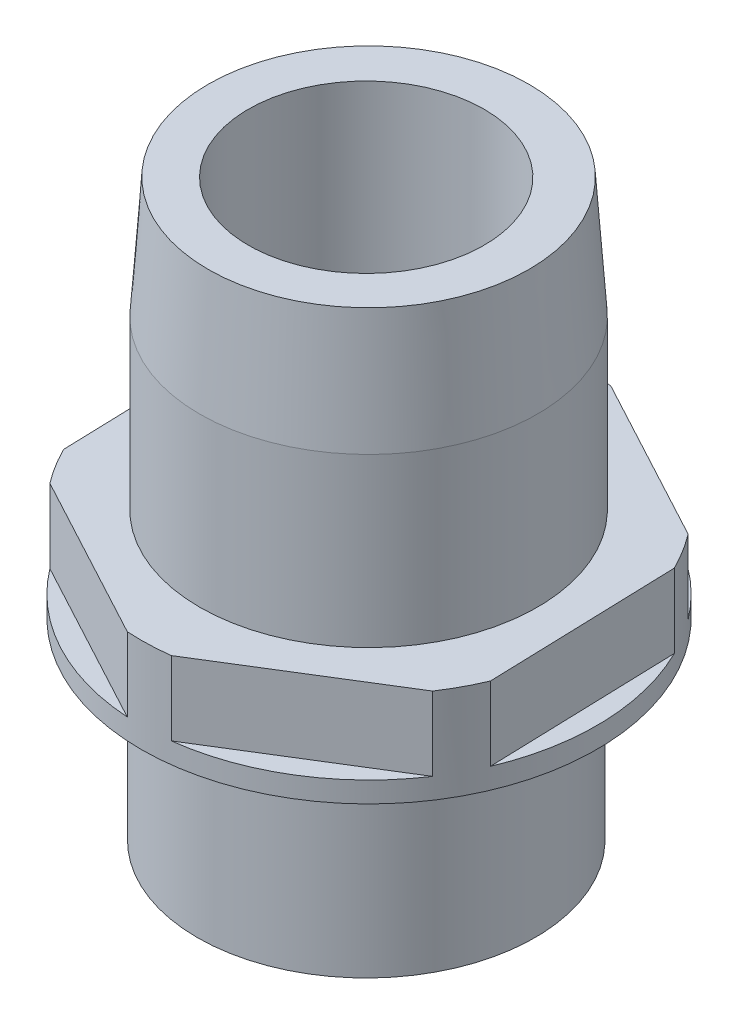
from build123d import *
from build123d.topology import SkipClean

# Parameters (mm, degrees)
SKETCH1_R           = 18.161
BOSS_EXTRUDE1_DEPTH = 1.651
BOSS_EXTRUDE2_DEPTH = 5.8928
CUT_EXTRUDE1_REACH  = 45.689
SKETCH5_R           = 13.462
BOSS_EXTRUDE3_DEPTH = 13.335
SKETCH6_R           = 13.462
BOSS_EXTRUDE4_DEPTH = 9.652
BOSS_EXTRUDE4_TAPER = 4
SKETCH7_R           = 13.462
BOSS_EXTRUDE5_DEPTH = 15.24
SKETCH8_R           = 9.398
CUT_EXTRUDE3_DEPTH  = 63.427016824


with BuildPart() as part:
    # Sketch1 → Boss-Extrude1 (new body)
    with BuildSketch(Plane(origin=(0, 0, 0), x_dir=(1, 0, 0), z_dir=(0, 1, 0))):
        with Locations(Location((-14.328841802, 9.162551515, 0), (0, 0, 90))):
            Circle(SKETCH1_R)
    extrude(amount=BOSS_EXTRUDE1_DEPTH)

    # Sketch2 → Boss-Extrude2 (add)
    with BuildSketch(Plane(origin=(0, 1.651, 0), x_dir=(1, 0, 0), z_dir=(0, 1, 0))):
        Polygon((2.466775283, 0.14327327), (1.879890825, 19.198343461), (-14.91572626, 28.217621706), (-31.124458887, 18.18182976), (-30.537574428, -0.87324043), (-13.741957343, -9.892518675), align=None)
    extrude(amount=BOSS_EXTRUDE2_DEPTH)

    # Sketch3 → Cut-Extrude1 (cut, up to next)
    with BuildSketch(Plane(origin=(0, 7.5438, 0), x_dir=(1, 0, 0), z_dir=(0, 1, 0)), mode=Mode.PRIVATE) as cut_extrude1_sk1:
        with BuildLine():
            Line((-13.183471606, 27.287397669), (-14.91572626, 28.217621706))
            Line((-14.91572626, 28.217621706), (-16.587451234, 27.182557187))
            ThreePointArc((-16.587451234, 27.182557187), (-14.887924337, 27.314943857), (-13.183471606, 27.287397669))
        make_face()
    cut_extrude1_tool1 = extrude(cut_extrude1_sk1.sketch, amount=-CUT_EXTRUDE1_REACH, mode=Mode.PRIVATE) & part.part
    # Sketch3 → Cut-Extrude1 (cut, up to next)
    with BuildSketch(Plane(origin=(0, 7.5438, 0), x_dir=(1, 0, 0), z_dir=(0, 1, 0)), mode=Mode.PRIVATE) as cut_extrude1_sk2:
        with BuildLine():
            Line((1.879890825, 19.198343461), (0.147636171, 20.128567497))
            ThreePointArc((0.147636171, 20.128567497), (1.112049838, 18.722927364), (1.940420505, 17.233054906))
            Line((1.940420505, 17.233054906), (1.879890825, 19.198343461))
        make_face()
    cut_extrude1_tool2 = extrude(cut_extrude1_sk2.sketch, amount=-CUT_EXTRUDE1_REACH, mode=Mode.PRIVATE) & part.part
    # Sketch3 → Cut-Extrude1 (cut, up to next)
    with BuildSketch(Plane(origin=(0, 7.5438, 0), x_dir=(1, 0, 0), z_dir=(0, 1, 0)), mode=Mode.PRIVATE) as cut_extrude1_sk3:
        with BuildLine():
            Line((-31.124458887, 18.18182976), (-31.063929206, 16.216541206))
            ThreePointArc((-31.063929206, 16.216541206), (-30.328815977, 17.754568007), (-29.452733913, 19.216894278))
            Line((-29.452733913, 19.216894278), (-31.124458887, 18.18182976))
        make_face()
    cut_extrude1_tool3 = extrude(cut_extrude1_sk3.sketch, amount=-CUT_EXTRUDE1_REACH, mode=Mode.PRIVATE) & part.part
    # Sketch3 → Cut-Extrude1 (cut, up to next)
    with BuildSketch(Plane(origin=(0, 7.5438, 0), x_dir=(1, 0, 0), z_dir=(0, 1, 0)), mode=Mode.PRIVATE) as cut_extrude1_sk4:
        with BuildLine():
            Line((-30.537574428, -0.87324043), (-28.805319774, -1.803464467))
            ThreePointArc((-28.805319774, -1.803464467), (-29.769733441, -0.397824334), (-30.598104109, 1.092048124))
            Line((-30.598104109, 1.092048124), (-30.537574428, -0.87324043))
        make_face()
    cut_extrude1_tool4 = extrude(cut_extrude1_sk4.sketch, amount=-CUT_EXTRUDE1_REACH, mode=Mode.PRIVATE) & part.part
    # Sketch3 → Cut-Extrude1 (cut, up to next)
    with BuildSketch(Plane(origin=(0, 7.5438, 0), x_dir=(1, 0, 0), z_dir=(0, 1, 0)), mode=Mode.PRIVATE) as cut_extrude1_sk5:
        with BuildLine():
            Line((-13.741957343, -9.892518675), (-12.070232369, -8.857454157))
            ThreePointArc((-12.070232369, -8.857454157), (-13.769759266, -8.989840826), (-15.474211997, -8.962294639))
            Line((-15.474211997, -8.962294639), (-13.741957343, -9.892518675))
        make_face()
    cut_extrude1_tool5 = extrude(cut_extrude1_sk5.sketch, amount=-CUT_EXTRUDE1_REACH, mode=Mode.PRIVATE) & part.part
    # Sketch3 → Cut-Extrude1 (cut, up to next)
    with BuildSketch(Plane(origin=(0, 7.5438, 0), x_dir=(1, 0, 0), z_dir=(0, 1, 0)), mode=Mode.PRIVATE) as cut_extrude1_sk6:
        with BuildLine():
            Line((2.466775283, 0.14327327), (2.406245603, 2.108561825))
            ThreePointArc((2.406245603, 2.108561825), (1.671132373, 0.570535023), (0.79505031, -0.891791248))
            Line((0.79505031, -0.891791248), (2.466775283, 0.14327327))
        make_face()
    cut_extrude1_tool6 = extrude(cut_extrude1_sk6.sketch, amount=-CUT_EXTRUDE1_REACH, mode=Mode.PRIVATE) & part.part
    add(cut_extrude1_tool1.solids().sort_by_distance((-14.896658, 7.5438, -27.598516))[0], mode=Mode.SUBTRACT)
    add(cut_extrude1_tool2.solids().sort_by_distance((1.353263, 7.5438, -18.872277))[0], mode=Mode.SUBTRACT)
    add(cut_extrude1_tool3.solids().sort_by_distance((-30.578763, 7.5438, -17.88879))[0], mode=Mode.SUBTRACT)
    add(cut_extrude1_tool4.solids().sort_by_distance((-30.010947, 7.5438, 0.547174))[0], mode=Mode.SUBTRACT)
    add(cut_extrude1_tool5.solids().sort_by_distance((-13.761025, 7.5438, 9.273413))[0], mode=Mode.SUBTRACT)
    add(cut_extrude1_tool6.solids().sort_by_distance((1.92108, 7.5438, -0.436313))[0], mode=Mode.SUBTRACT)

    # Sketch5 → Boss-Extrude3 (add)
    with SkipClean():  # the faces are left unmerged after this step: merging them gives an invalid solid
        with BuildSketch(Plane(origin=(0, 7.5438, 0), x_dir=(1, 0, 0), z_dir=(0, 1, 0))):
            with Locations(Location((-14.273901773, 9.073818285, 0), (0, 0, 270))):
                Circle(SKETCH5_R)
        extrude(amount=BOSS_EXTRUDE3_DEPTH)

    # Sketch6 → Boss-Extrude4 (add)
    with SkipClean():  # the faces are left unmerged after this step: merging them gives an invalid solid
        with BuildSketch(Plane(origin=(0, 20.8788, 0), x_dir=(1, 0, 0), z_dir=(0, 1, 0))):
            with Locations(Location((-14.273901773, 9.073818285, 0), (0, 0, 270))):
                Circle(SKETCH6_R)
        extrude(amount=BOSS_EXTRUDE4_DEPTH, taper=BOSS_EXTRUDE4_TAPER)

    # Sketch7 → Boss-Extrude5 (add)
    with SkipClean():  # the faces are left unmerged after this step: merging them gives an invalid solid
        with BuildSketch(Plane.XZ):
            with Locations(Location((-14.33942015, -8.950735224, 0), (0, 0, 90))):
                Circle(SKETCH7_R)
        extrude(amount=BOSS_EXTRUDE5_DEPTH)

    # Sketch8 → Cut-Extrude3 (cut, through all)
    with SkipClean():  # the faces are left unmerged after this step: merging them gives an invalid solid
        with BuildSketch(Plane.XZ.offset(15.24)):
            with Locations(Location((-14.33942015, -8.950735224, 0), (0, 0, 270))):
                Circle(SKETCH8_R)
        extrude(amount=-CUT_EXTRUDE3_DEPTH, mode=Mode.SUBTRACT)


solid = part.part
